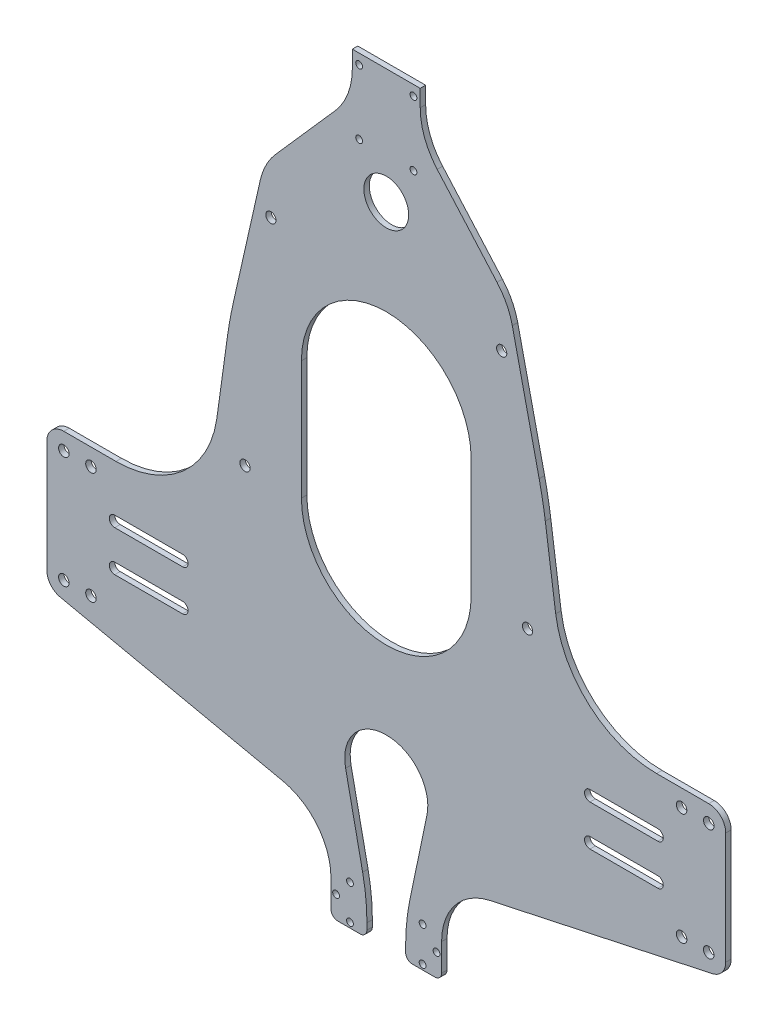
from build123d import *

# Parameters (mm, degrees)
SKETCH_1_R      = 1.5
SKETCH_1_R_2    = 1
SKETCH_1_R_3    = 6.6
SKETCH_1_R_4    = 1.55
EXTRUDE_1_DEPTH = 1.6


with BuildPart() as part:
    # 草图1 → 凸台-拉伸1 (new body)
    with BuildSketch(Plane.XY):
        with BuildLine():
            Line((28.3, -182.6), (21.7, -182.6))
            ThreePointArc((21.7, -182.6), (20.285786438, -182.014213562), (19.7, -180.6))
            Line((19.7, -180.6), (19.7, -172.540561017))
            ThreePointArc((19.7, -172.540561017), (15.702142896, -161.229504731), (5.484445076, -154.942891414))
            Line((5.484445076, -154.942891414), (-60.051234743, -140.849196829))
            ThreePointArc((-60.051234743, -140.849196829), (-62.889484138, -139.102915353), (-64, -135.960955273))
            Line((-64, -135.960955273), (-64, -103))
            ThreePointArc((-64, -103), (-62.535533906, -99.464466094), (-59, -98))
            Line((-59, -98), (-43.626727815, -98))
            ThreePointArc((-43.626727815, -98), (-23.924293673, -90.623308531), (-13.911111388, -72.120939259))
            Line((-13.911111388, -72.120939259), (-10.843078735, -49.997710609))
            ThreePointArc((-10.843078735, -49.997710609), (-10.045683656, -45.018963187), (-9.039840064, -40.078108658))
            Line((-9.039840064, -40.078108658), (-1.124995937, -4.987666714))
            ThreePointArc((-1.124995937, -4.987666714), (0.57285044, -0.292525766), (3.380699046, 3.835793148))
            Line((3.380699046, 3.835793148), (21.00417619, 23.831661447))
            ThreePointArc((21.00417619, 23.831661447), (24.709403034, 29.987566958), (26, 37.05568114))
            Line((26, 37.05568114), (26, 42))
            Line((26, 42), (46, 42))
            Line((46, 42), (46, 37.05568114))
            ThreePointArc((46, 37.05568114), (47.290596966, 29.987566958), (50.99582381, 23.831661447))
            Line((50.99582381, 23.831661447), (68.619300954, 3.835793148))
            ThreePointArc((68.619300954, 3.835793148), (71.42714956, -0.292525766), (73.124995937, -4.987666714))
            Line((73.124995937, -4.987666714), (81.039840064, -40.078108658))
            ThreePointArc((81.039840064, -40.078108658), (82.045683656, -45.018963187), (82.843078735, -49.997710609))
            Line((82.843078735, -49.997710609), (85.911111388, -72.120939259))
            ThreePointArc((85.911111388, -72.120939259), (95.924293673, -90.623308531), (115.626727815, -98))
            Line((115.626727815, -98), (131, -98))
            ThreePointArc((131, -98), (134.535533906, -99.464466094), (136, -103))
            Line((136, -103), (136, -135.960955273))
            ThreePointArc((136, -135.960955273), (134.889484138, -139.102915353), (132.051234743, -140.849196829))
            Line((132.051234743, -140.849196829), (66.515554924, -154.942891414))
            ThreePointArc((66.515554924, -154.942891414), (56.297857104, -161.229504731), (52.3, -172.540561017))
            Line((52.3, -172.540561017), (52.3, -180.6))
            ThreePointArc((52.3, -180.6), (51.714213562, -182.014213562), (50.3, -182.6))
            Line((50.3, -182.6), (43.7, -182.6))
            ThreePointArc((43.7, -182.6), (42.285786438, -182.014213562), (41.7, -180.6))
            Line((41.7, -180.6), (41.7, -178.737691249))
            ThreePointArc((41.7, -178.737691249), (42.017498822, -172.573354043), (42.966635106, -166.474255831))
            Line((42.966635106, -166.474255831), (47.982301372, -142.452687084))
            ThreePointArc((47.982301372, -142.452687084), (45.547777581, -132.431388668), (36.235628393, -128))
            Line((36.235628393, -128), (35.764371607, -128))
            ThreePointArc((35.764371607, -128), (26.452222419, -132.431388668), (24.017698628, -142.452687084))
            Line((24.017698628, -142.452687084), (29.033364894, -166.474255831))
            ThreePointArc((29.033364894, -166.474255831), (29.982501178, -172.573354043), (30.3, -178.737691249))
            Line((30.3, -178.737691249), (30.3, -180.6))
            ThreePointArc((30.3, -180.6), (29.714213562, -182.014213562), (28.3, -182.6))
        make_face()
        with Locations((2, -12.95)):
            Circle(SKETCH_1_R, mode=Mode.SUBTRACT)
        with Locations(Location((70, -12.95, 0), (0, 0, 180))):
            Circle(SKETCH_1_R, mode=Mode.SUBTRACT)
        with Locations((-5.6215, -80.046)):
            Circle(SKETCH_1_R, mode=Mode.SUBTRACT)
        with Locations(Location((77.6215, -80.046, 0), (0, 0, 180))):
            Circle(SKETCH_1_R, mode=Mode.SUBTRACT)
        with Locations((25.3, -170.9)):
            Circle(SKETCH_1_R_2, mode=Mode.SUBTRACT)
        with Locations((25.3, -181.1)):
            Circle(SKETCH_1_R_2, mode=Mode.SUBTRACT)
        with Locations((21.2, -176)):
            Circle(SKETCH_1_R_2, mode=Mode.SUBTRACT)
        with Locations(Location((46.7, -181.1, 0), (0, 0, 180))):
            Circle(SKETCH_1_R_2, mode=Mode.SUBTRACT)
        with Locations(Location((50.8, -176, 0), (0, 0, 180))):
            Circle(SKETCH_1_R_2, mode=Mode.SUBTRACT)
        with Locations(Location((46.7, -170.9, 0), (0, 0, 180))):
            Circle(SKETCH_1_R_2, mode=Mode.SUBTRACT)
        with Locations((28, 39)):
            Circle(SKETCH_1_R_2, mode=Mode.SUBTRACT)
        with Locations(Location((44, 39, 0), (0, 0, 180))):
            Circle(SKETCH_1_R_2, mode=Mode.SUBTRACT)
        with Locations((44, 20)):
            Circle(SKETCH_1_R_2, mode=Mode.SUBTRACT)
        with Locations(Location((28, 20, 0), (0, 0, 180))):
            Circle(SKETCH_1_R_2, mode=Mode.SUBTRACT)
        with Locations((36, 8)):
            Circle(SKETCH_1_R_3, mode=Mode.SUBTRACT)
        with Locations((-59, -103)):
            Circle(SKETCH_1_R_4, mode=Mode.SUBTRACT)
        with Locations((-59, -135.960955273)):
            Circle(SKETCH_1_R_4, mode=Mode.SUBTRACT)
        with Locations(Location((-51, -135.960955273, 0), (0, 0, 180))):
            Circle(SKETCH_1_R_4, mode=Mode.SUBTRACT)
        with Locations(Location((-51, -103, 0), (0, 0, 180))):
            Circle(SKETCH_1_R_4, mode=Mode.SUBTRACT)
        with Locations(Location((131, -135.960955273, 0), (0, 0, 180))):
            Circle(SKETCH_1_R_4, mode=Mode.SUBTRACT)
        with Locations((123, -135.960955273)):
            Circle(SKETCH_1_R_4, mode=Mode.SUBTRACT)
        with Locations((123, -103)):
            Circle(SKETCH_1_R_4, mode=Mode.SUBTRACT)
        with Locations(Location((131, -103, 0), (0, 0, 180))):
            Circle(SKETCH_1_R_4, mode=Mode.SUBTRACT)
        with BuildLine():
            Line((11, -80.046), (11, -45))
            ThreePointArc((11, -45), (36, -20), (61, -45))
            Line((61, -45), (61, -80.046))
            ThreePointArc((61, -80.046), (36, -105.046), (11, -80.046))
        make_face(mode=Mode.SUBTRACT)
        with BuildLine():
            Line((-44, -111.880477636), (-24, -111.880477636))
            ThreePointArc((-24, -111.880477636), (-22.4, -113.480477636), (-24, -115.080477636))
            Line((-24, -115.080477636), (-44, -115.080477636))
            ThreePointArc((-44, -115.080477636), (-45.6, -113.480477636), (-44, -111.880477636))
        make_face(mode=Mode.SUBTRACT)
        with BuildLine():
            Line((-44, -127.080477636), (-24, -127.080477636))
            ThreePointArc((-24, -127.080477636), (-22.4, -125.480477636), (-24, -123.880477636))
            Line((-24, -123.880477636), (-44, -123.880477636))
            ThreePointArc((-44, -123.880477636), (-45.6, -125.480477636), (-44, -127.080477636))
        make_face(mode=Mode.SUBTRACT)
        with BuildLine():
            Line((116, -111.880477636), (96, -111.880477636))
            ThreePointArc((96, -111.880477636), (94.4, -113.480477636), (96, -115.080477636))
            Line((96, -115.080477636), (116, -115.080477636))
            ThreePointArc((116, -115.080477636), (117.6, -113.480477636), (116, -111.880477636))
        make_face(mode=Mode.SUBTRACT)
        with BuildLine():
            Line((116, -127.080477636), (96, -127.080477636))
            ThreePointArc((96, -127.080477636), (94.4, -125.480477636), (96, -123.880477636))
            Line((96, -123.880477636), (116, -123.880477636))
            ThreePointArc((116, -123.880477636), (117.6, -125.480477636), (116, -127.080477636))
        make_face(mode=Mode.SUBTRACT)
    extrude(amount=EXTRUDE_1_DEPTH)


solid = part.part
